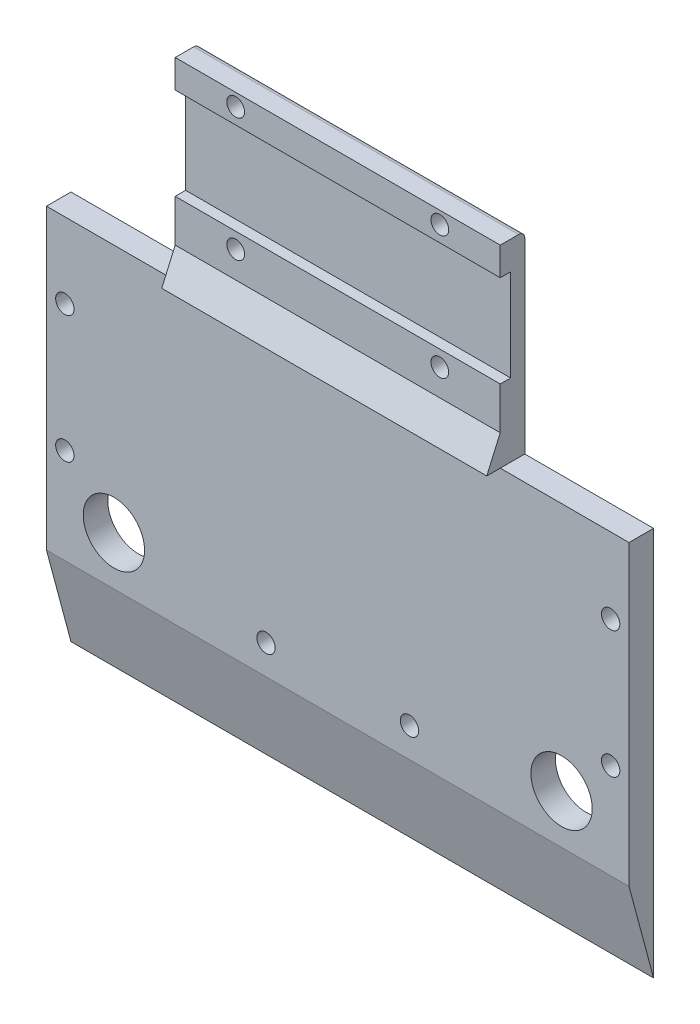
from build123d import *

# Parameters (mm, degrees)
CROQUIS1_W              = 95
CROQUIS1_H              = 95
SALIENTE_EXTRUIR1_DEPTH = 4
CORTAR_EXTRUIR1_DEPTH   = 100
CROQUIS5_W              = 21
CROQUIS5_H              = 31.5
CORTAR_EXTRUIR2_DEPTH   = 100
CROQUIS6_W              = 21
CROQUIS6_H              = 31.5
CORTAR_EXTRUIR3_DEPTH   = 100
CROQUIS7_W              = 3
CROQUIS7_H              = 15
CORTAR_EXTRUIR4_DEPTH   = 100
REDONDEO1_R             = 1
CROQUIS8_R              = 5
CORTAR_EXTRUIR5_DEPTH   = 10
SALIENTE_EXTRUIR2_DEPTH = 53
CROQUIS10_R             = 1.5
CORTAR_EXTRUIR6_DEPTH   = 10
CROQUIS11_R             = 1.45
CORTAR_EXTRUIR7_DEPTH   = 20


with BuildPart() as part:
    # Croquis1 → Saliente-Extruir1 (new body)
    with BuildSketch(Plane.XY):
        with Locations((56.776857567, -29.52358237)):
            Rectangle(CROQUIS1_W, CROQUIS1_H)
    extrude(amount=SALIENTE_EXTRUIR1_DEPTH)

    # Croquis3 → Cortar-Extruir1 (cut)
    with BuildSketch(Plane.ZY.offset(-9.276857567)):
        Polygon((4, -62.076521477), (0, -77.02358237), (4, -77.02358237), align=None)
    extrude(amount=-CORTAR_EXTRUIR1_DEPTH, mode=Mode.SUBTRACT)

    # Croquis5 → Cortar-Extruir2 (cut)
    with BuildSketch(Plane.XY.offset(4)):
        with Locations((19.776857567, 2.22641763)):
            Rectangle(CROQUIS5_W, CROQUIS5_H)
    extrude(amount=-CORTAR_EXTRUIR2_DEPTH, mode=Mode.SUBTRACT)

    # Croquis6 → Cortar-Extruir3 (cut)
    with BuildSketch(Plane.XY.offset(4)):
        with Locations((93.776857567, 2.22641763)):
            Rectangle(CROQUIS6_W, CROQUIS6_H)
    extrude(amount=-CORTAR_EXTRUIR3_DEPTH, mode=Mode.SUBTRACT)

    # Croquis7 → Cortar-Extruir4 (cut)
    with BuildSketch(Plane.ZY.offset(-30.276857567)):
        with Locations((3.808437884, 5.867431485)):
            Rectangle(CROQUIS7_W, CROQUIS7_H)
    extrude(amount=-CORTAR_EXTRUIR4_DEPTH, mode=Mode.SUBTRACT)

    # Redondeo1
    redondeo1_edges = [part.edges().sort_by_distance(p)[0] for p in [
        (56.776857567, 17.97641763, 0),
    ]]
    fillet(redondeo1_edges, radius=REDONDEO1_R)

    # Croquis8 → Cortar-Extruir5 (cut)
    with BuildSketch(Plane(origin=(0, 0, 0), x_dir=(-1, 0, 0), z_dir=(0, 0, -1))):
        with Locations((-93.276857567, -54.130923869)):
            Circle(CROQUIS8_R)
        with Locations((-20.276857567, -54.130923869)):
            Circle(CROQUIS8_R)
    extrude(amount=-CORTAR_EXTRUIR5_DEPTH, mode=Mode.SUBTRACT)

    # Croquis9 → Saliente-Extruir2 (add)
    with BuildSketch(Plane.ZY.offset(-30.276857567)):
        Polygon((4, -13.52358237), (4, -8.52358237), (6.2, -13.52358237), align=None)
    extrude(amount=-SALIENTE_EXTRUIR2_DEPTH)

    # Croquis10 → Cortar-Extruir6 (cut)
    with BuildSketch(Plane.XY.offset(4)):
        with Locations((12.276857567, -25.82358237)):
            Circle(CROQUIS10_R)
        with Locations((12.276857567, -46.52358237)):
            Circle(CROQUIS10_R)
        with Locations((45.076857567, -57.276521477)):
            Circle(CROQUIS10_R)
        with Locations((68.476857567, -57.276521477)):
            Circle(CROQUIS10_R)
        with Locations((101.276857567, -25.82358237)):
            Circle(CROQUIS10_R)
        with Locations((101.276857567, -46.52358237)):
            Circle(CROQUIS10_R)
    extrude(amount=-CORTAR_EXTRUIR6_DEPTH, mode=Mode.SUBTRACT)

    # Croquis11 → Cortar-Extruir7 (cut)
    with BuildSketch(Plane.XY.offset(4)):
        with Locations((40.129677313, 15.935254897)):
            Circle(CROQUIS11_R)
        with Locations((73.424037821, 15.935254897)):
            Circle(CROQUIS11_R)
        with Locations((40.129677313, -4.182419638)):
            Circle(CROQUIS11_R)
        with Locations((73.424037821, -4.182419638)):
            Circle(CROQUIS11_R)
    extrude(amount=-CORTAR_EXTRUIR7_DEPTH, mode=Mode.SUBTRACT)


solid = part.part
